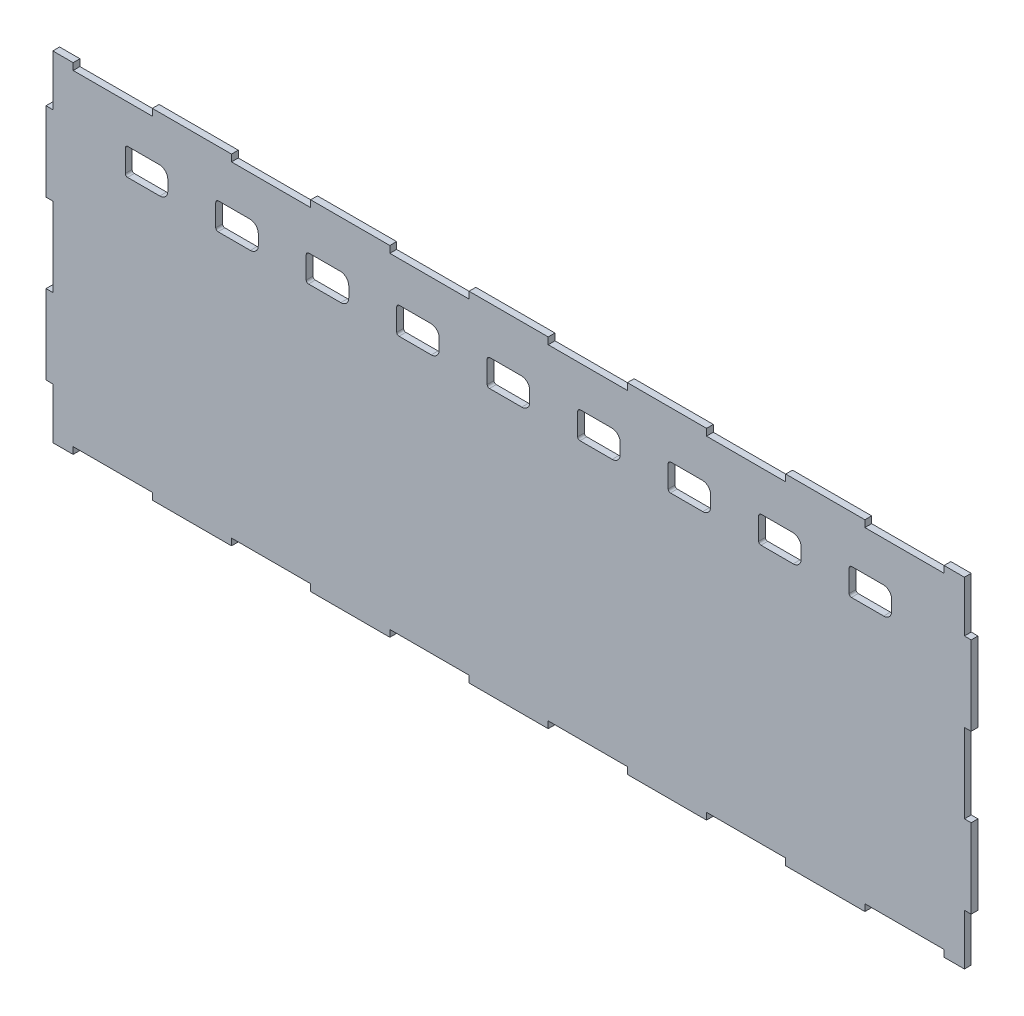
from build123d import *

# Parameters (mm, degrees)
BOSS_EXTRUDE1_DEPTH = 3
CUT_EXTRUDE1_DEPTH  = 218.839964194


with BuildPart() as part:
    # Model → Boss-Extrude1 (new body)
    with BuildSketch(Plane.XY):
        Polygon((201.5, 75), (192.5, 75), (192.5, 72), (157.5, 72), (157.5, 75), (122.5, 75), (122.5, 72), (87.5, 72), (87.5, 75), (52.5, 75), (52.5, 72), (17.5, 72), (17.5, 75), (-17.5, 75), (-17.5, 72), (-52.5, 72), (-52.5, 75), (-87.5, 75), (-87.5, 72), (-122.5, 72), (-122.5, 75), (-157.5, 75), (-157.5, 72), (-192.5, 72), (-192.5, 75), (-201.5, 75), (-201.5, 72), (-201.5, 52.5), (-204.5, 52.5), (-204.5, 17.5), (-201.5, 17.5), (-201.5, -17.5), (-204.5, -17.5), (-204.5, -52.5), (-201.5, -52.5), (-201.5, -72), (-201.5, -75), (-192.5, -75), (-192.5, -72), (-157.5, -72), (-157.5, -75), (-122.5, -75), (-122.5, -72), (-87.5, -72), (-87.5, -75), (-52.5, -75), (-52.5, -72), (-17.5, -72), (-17.5, -75), (17.5, -75), (17.5, -72), (52.5, -72), (52.5, -75), (87.5, -75), (87.5, -72), (122.5, -72), (122.5, -75), (157.5, -75), (157.5, -72), (192.5, -72), (192.5, -75), (201.5, -75), (201.5, -72), (201.5, -52.5), (204.5, -52.5), (204.5, -17.5), (201.5, -17.5), (201.5, 17.5), (204.5, 17.5), (204.5, 52.5), (201.5, 52.5), (201.5, 72), align=None)
    extrude(amount=BOSS_EXTRUDE1_DEPTH)

    # Sketch1 → Cut-Extrude1 (cut, through all)
    with BuildSketch(Plane.XY.offset(3)):
        with BuildLine():
            Line((-154.186662726, 43.1), (-168.461662726, 43.1))
            ThreePointArc((-168.461662726, 43.1), (-169.168769507, 43.392893219), (-169.461662726, 44.1))
            Line((-169.461662726, 44.1), (-169.461662726, 53.8))
            ThreePointArc((-169.461662726, 53.8), (-169.110190863, 54.648528137), (-168.261662726, 55))
            Line((-168.261662726, 55), (-154.386662726, 55))
            ThreePointArc((-154.386662726, 55), (-151.752689966, 53.90897276), (-150.661662726, 51.275))
            Line((-150.661662726, 51.275), (-150.661662726, 46.625))
            ThreePointArc((-150.661662726, 46.625), (-151.694111322, 44.132448596), (-154.186662726, 43.1))
        make_face()
        with BuildLine():
            Line((-114.186662726, 42.283204501), (-128.461662726, 42.283204501))
            ThreePointArc((-128.461662726, 42.283204501), (-129.168769507, 42.57609772), (-129.461662726, 43.283204501))
            Line((-129.461662726, 43.283204501), (-129.461662726, 52.983204501))
            ThreePointArc((-129.461662726, 52.983204501), (-129.110190863, 53.831732638), (-128.261662726, 54.183204501))
            Line((-128.261662726, 54.183204501), (-114.386662726, 54.183204501))
            ThreePointArc((-114.386662726, 54.183204501), (-111.752689966, 53.092177261), (-110.661662726, 50.458204501))
            Line((-110.661662726, 50.458204501), (-110.661662726, 45.808204501))
            ThreePointArc((-110.661662726, 45.808204501), (-111.694111322, 43.315653097), (-114.186662726, 42.283204501))
        make_face()
        with BuildLine():
            Line((-74.186662726, 42.283204501), (-88.461662726, 42.283204501))
            ThreePointArc((-88.461662726, 42.283204501), (-89.168769507, 42.57609772), (-89.461662726, 43.283204501))
            Line((-89.461662726, 43.283204501), (-89.461662726, 52.983204501))
            ThreePointArc((-89.461662726, 52.983204501), (-89.110190863, 53.831732638), (-88.261662726, 54.183204501))
            Line((-88.261662726, 54.183204501), (-74.386662726, 54.183204501))
            ThreePointArc((-74.386662726, 54.183204501), (-71.752689966, 53.092177261), (-70.661662726, 50.458204501))
            Line((-70.661662726, 50.458204501), (-70.661662726, 45.808204501))
            ThreePointArc((-70.661662726, 45.808204501), (-71.694111322, 43.315653097), (-74.186662726, 42.283204501))
        make_face()
        with BuildLine():
            Line((-34.186662726, 42.283204501), (-48.461662726, 42.283204501))
            ThreePointArc((-48.461662726, 42.283204501), (-49.168769507, 42.57609772), (-49.461662726, 43.283204501))
            Line((-49.461662726, 43.283204501), (-49.461662726, 52.983204501))
            ThreePointArc((-49.461662726, 52.983204501), (-49.110190863, 53.831732638), (-48.261662726, 54.183204501))
            Line((-48.261662726, 54.183204501), (-34.386662726, 54.183204501))
            ThreePointArc((-34.386662726, 54.183204501), (-31.752689966, 53.092177261), (-30.661662726, 50.458204501))
            Line((-30.661662726, 50.458204501), (-30.661662726, 45.808204501))
            ThreePointArc((-30.661662726, 45.808204501), (-31.694111322, 43.315653097), (-34.186662726, 42.283204501))
        make_face()
        with BuildLine():
            Line((5.813337274, 42.283204501), (-8.461662726, 42.283204501))
            ThreePointArc((-8.461662726, 42.283204501), (-9.168769507, 42.57609772), (-9.461662726, 43.283204501))
            Line((-9.461662726, 43.283204501), (-9.461662726, 52.983204501))
            ThreePointArc((-9.461662726, 52.983204501), (-9.110190863, 53.831732638), (-8.261662726, 54.183204501))
            Line((-8.261662726, 54.183204501), (5.613337274, 54.183204501))
            ThreePointArc((5.613337274, 54.183204501), (8.247310034, 53.092177261), (9.338337274, 50.458204501))
            Line((9.338337274, 50.458204501), (9.338337274, 45.808204501))
            ThreePointArc((9.338337274, 45.808204501), (8.305888678, 43.315653097), (5.813337274, 42.283204501))
        make_face()
        with BuildLine():
            Line((45.813337274, 42.283204501), (31.538337274, 42.283204501))
            ThreePointArc((31.538337274, 42.283204501), (30.831230493, 42.57609772), (30.538337274, 43.283204501))
            Line((30.538337274, 43.283204501), (30.538337274, 52.983204501))
            ThreePointArc((30.538337274, 52.983204501), (30.889809137, 53.831732638), (31.738337274, 54.183204501))
            Line((31.738337274, 54.183204501), (45.613337274, 54.183204501))
            ThreePointArc((45.613337274, 54.183204501), (48.247310034, 53.092177261), (49.338337274, 50.458204501))
            Line((49.338337274, 50.458204501), (49.338337274, 45.808204501))
            ThreePointArc((49.338337274, 45.808204501), (48.305888678, 43.315653097), (45.813337274, 42.283204501))
        make_face()
        with BuildLine():
            Line((85.813337274, 42.283204501), (71.538337274, 42.283204501))
            ThreePointArc((71.538337274, 42.283204501), (70.831230493, 42.57609772), (70.538337274, 43.283204501))
            Line((70.538337274, 43.283204501), (70.538337274, 52.983204501))
            ThreePointArc((70.538337274, 52.983204501), (70.889809137, 53.831732638), (71.738337274, 54.183204501))
            Line((71.738337274, 54.183204501), (85.613337274, 54.183204501))
            ThreePointArc((85.613337274, 54.183204501), (88.247310034, 53.092177261), (89.338337274, 50.458204501))
            Line((89.338337274, 50.458204501), (89.338337274, 45.808204501))
            ThreePointArc((89.338337274, 45.808204501), (88.305888678, 43.315653097), (85.813337274, 42.283204501))
        make_face()
        with BuildLine():
            Line((125.813337274, 42.283204501), (111.538337274, 42.283204501))
            ThreePointArc((111.538337274, 42.283204501), (110.831230493, 42.57609772), (110.538337274, 43.283204501))
            Line((110.538337274, 43.283204501), (110.538337274, 52.983204501))
            ThreePointArc((110.538337274, 52.983204501), (110.889809137, 53.831732638), (111.738337274, 54.183204501))
            Line((111.738337274, 54.183204501), (125.613337274, 54.183204501))
            ThreePointArc((125.613337274, 54.183204501), (128.247310034, 53.092177261), (129.338337274, 50.458204501))
            Line((129.338337274, 50.458204501), (129.338337274, 45.808204501))
            ThreePointArc((129.338337274, 45.808204501), (128.305888678, 43.315653097), (125.813337274, 42.283204501))
        make_face()
        with BuildLine():
            Line((165.813337274, 42.283204501), (151.538337274, 42.283204501))
            ThreePointArc((151.538337274, 42.283204501), (150.831230493, 42.57609772), (150.538337274, 43.283204501))
            Line((150.538337274, 43.283204501), (150.538337274, 52.983204501))
            ThreePointArc((150.538337274, 52.983204501), (150.889809137, 53.831732638), (151.738337274, 54.183204501))
            Line((151.738337274, 54.183204501), (165.613337274, 54.183204501))
            ThreePointArc((165.613337274, 54.183204501), (168.247310034, 53.092177261), (169.338337274, 50.458204501))
            Line((169.338337274, 50.458204501), (169.338337274, 45.808204501))
            ThreePointArc((169.338337274, 45.808204501), (168.305888678, 43.315653097), (165.813337274, 42.283204501))
        make_face()
    extrude(amount=-CUT_EXTRUDE1_DEPTH, mode=Mode.SUBTRACT)


solid = part.part
